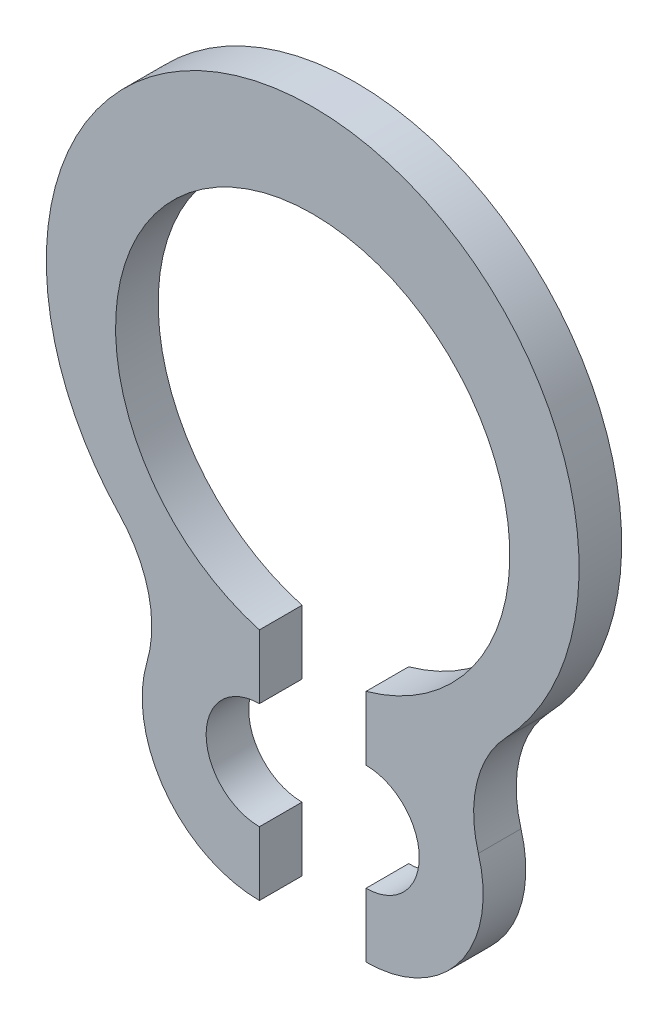
from build123d import *

# Parameters (mm, degrees)
BODY_DEPTH = 0.4


with BuildPart() as part:
    # Sketch1 → Body (new body)
    with BuildSketch(Plane.XY):
        with BuildLine():
            Line((-0.5, -2.001151313), (-0.5, -2.601151313))
            ThreePointArc((-0.5, -2.601151313), (-1, -3.101151313), (-0.5, -3.601151313))
            Line((-0.5, -3.601151313), (-0.5, -4.201151313))
            ThreePointArc((-0.5, -4.201151313), (-1.380926142, -3.759914649), (-1.555130625, -2.7901861))
            ThreePointArc((-1.555130625, -2.7901861), (-1.540887742, -2.221460727), (-1.812681424, -1.721681171))
            ThreePointArc((-1.812681424, -1.721681171), (0, 2.5), (1.812681424, -1.721681171))
            ThreePointArc((1.812681424, -1.721681171), (1.540887742, -2.221460727), (1.555130625, -2.7901861))
            ThreePointArc((1.555130625, -2.7901861), (1.380926142, -3.759914649), (0.5, -4.201151313))
            Line((0.5, -4.201151313), (0.5, -3.601151313))
            ThreePointArc((0.5, -3.601151313), (1, -3.101151313), (0.5, -2.601151313))
            Line((0.5, -2.601151313), (0.5, -2.001151313))
            ThreePointArc((0.5, -2.001151313), (0, 1.63), (-0.5, -2.001151313))
        make_face()
    extrude(amount=-BODY_DEPTH)


solid = part.part
